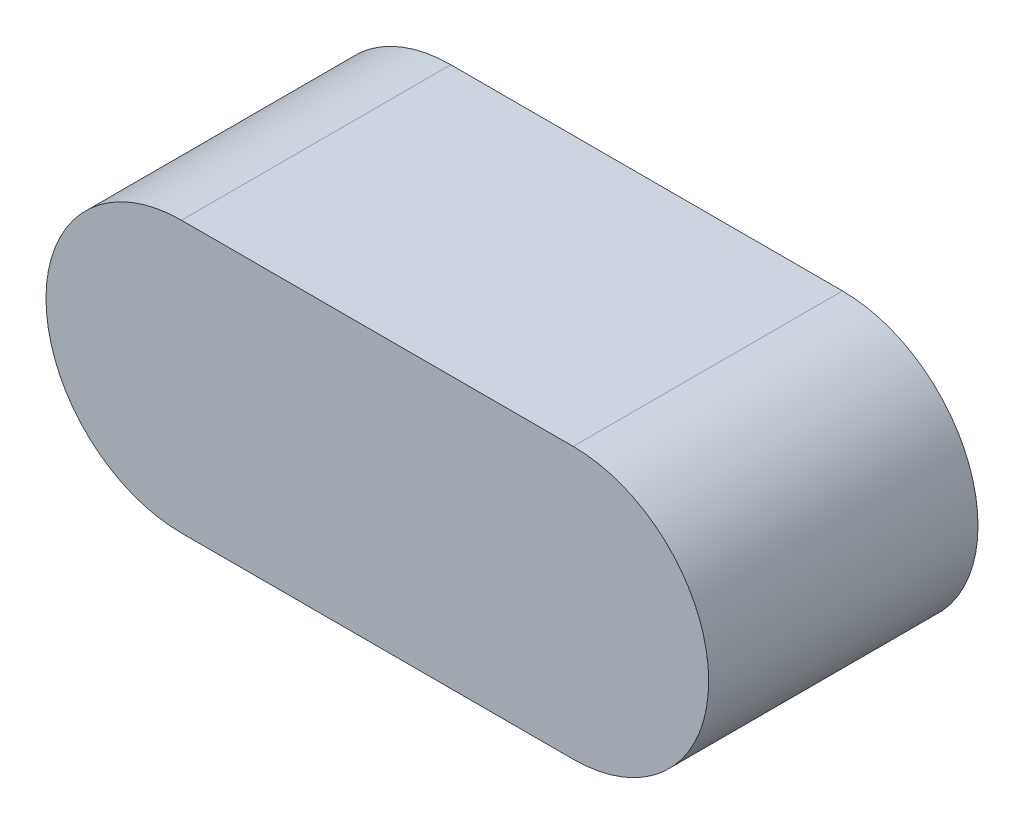
from build123d import *

# Parameters (mm, degrees)
BOSS_EXTRU_2_DEPTH = 162
COQUE1_T           = 3


with BuildPart() as part:
    # Esquisse1 → Boss.-Extru.2 (new body)
    with BuildSketch(Plane.XY):
        with BuildLine():
            Line((-120, 80), (120, 80))
            ThreePointArc((120, 80), (200, 0), (120, -80))
            Line((120, -80), (-120, -80))
            ThreePointArc((-120, -80), (-200, 0), (-120, 80))
        make_face()
    extrude(amount=BOSS_EXTRU_2_DEPTH)

    # Coque1
    coque1_openings = [part.faces().sort_by_distance(p)[0] for p in [
        (0, 0, 0),
    ]]
    offset(amount=COQUE1_T, openings=coque1_openings, kind=Kind.INTERSECTION)


solid = part.part
